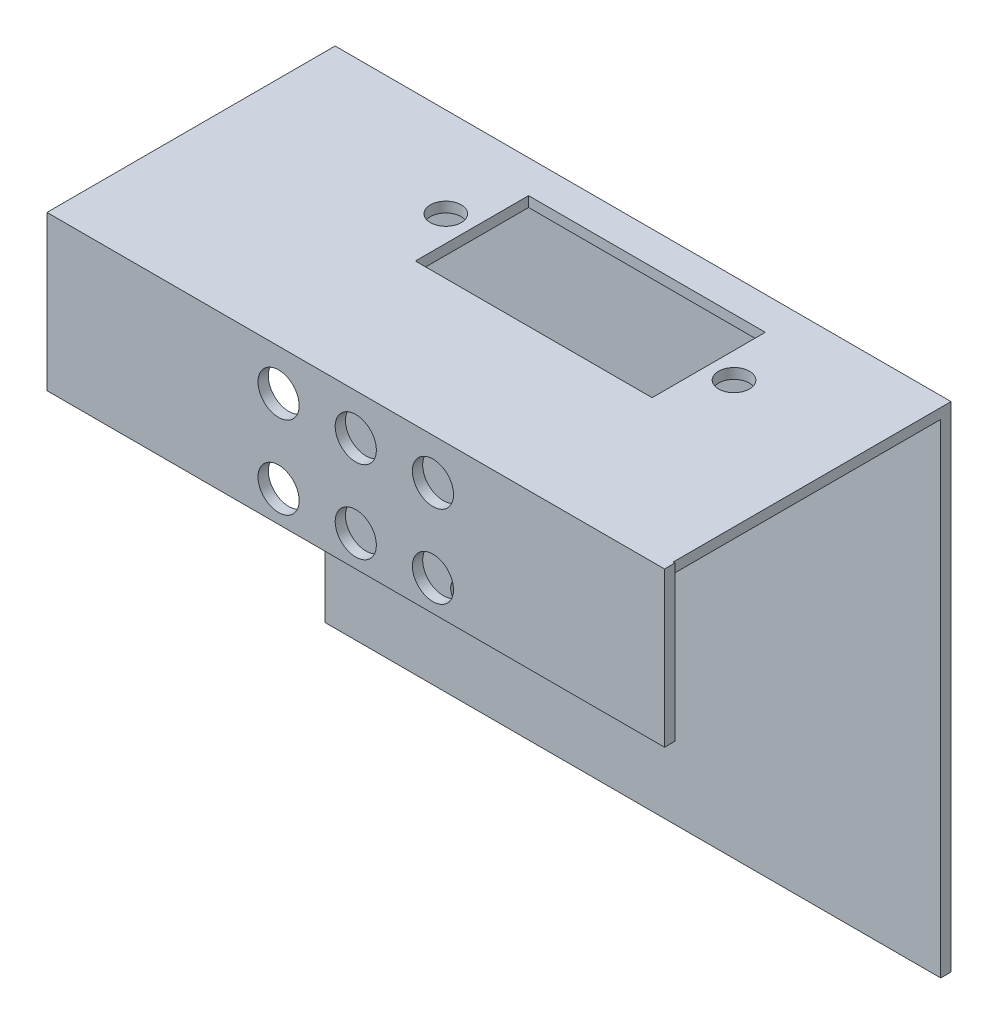
from build123d import *

# Parameters (mm, degrees)
ESQUISSE1_W             = 60
ESQUISSE1_H             = 15
BOSS_EXTRU_1_DEPTH      = 1
ESQUISSE2_W             = 59.836868209
ESQUISSE2_H             = 27
BOSS_EXTRU_2_DEPTH      = 1
ESQUISSE4_W             = 59.836868209
ESQUISSE4_H             = 47
BOSS_EXTRU_3_DEPTH      = 1
ESQUISSE6_R             = 2
ENL_V_MAT_EXTRU_5_DEPTH = 1
ESQUISSE8_W             = 23
ESQUISSE8_H             = 11
ENL_V_MAT_EXTRU_7_DEPTH = 1
ESQUISSE9_R             = 1.5
ENL_V_MAT_EXTRU_8_DEPTH = 1
ESQUISSE10_R            = 1.25
ENL_V_MAT_EXTRU_9_DEPTH = 1


with BuildPart() as part:
    # Esquisse1 → Boss.-Extru.1 (new body)
    with BuildSketch(Plane.XY):
        Rectangle(ESQUISSE1_W, ESQUISSE1_H)
    extrude(amount=BOSS_EXTRU_1_DEPTH)

    # Esquisse2 → Boss.-Extru.2 (add)
    with BuildSketch(Plane(origin=(0, 7.5, 0), x_dir=(1, 0, 0), z_dir=(0, 1, 0))):
        with Locations((-0.085609374, 13.5)):
            Rectangle(ESQUISSE2_W, ESQUISSE2_H)
    extrude(amount=-BOSS_EXTRU_2_DEPTH)

    # Esquisse4 → Boss.-Extru.3 (add)
    with BuildSketch(Plane.XY.offset(-27)):
        with Locations((-0.085609374, -17)):
            Rectangle(ESQUISSE4_W, ESQUISSE4_H)
    extrude(amount=BOSS_EXTRU_3_DEPTH)

    # Esquisse6 → Enlèv. mat.-Extru.5 (cut)
    with BuildSketch(Plane.XY.offset(1)):
        with Locations((-7.5, 3.5)):
            Circle(ESQUISSE6_R)
        with Locations((0, 3.5)):
            Circle(ESQUISSE6_R)
        with Locations((7.5, 3.5)):
            Circle(ESQUISSE6_R)
        with Locations(Location((7.5, -4.5, 0), (0, 0, 180))):
            Circle(ESQUISSE6_R)
        with Locations(Location((0, -4.5, 0), (0, 0, 180))):
            Circle(ESQUISSE6_R)
        with Locations(Location((-7.5, -4.5, 0), (0, 0, 180))):
            Circle(ESQUISSE6_R)
    extrude(amount=-ENL_V_MAT_EXTRU_5_DEPTH, mode=Mode.SUBTRACT)

    # Esquisse8 → Enlèv. mat.-Extru.7 (cut)
    with BuildSketch(Plane(origin=(0, 7.5, 0), x_dir=(1, 0, 0), z_dir=(0, 1, 0))):
        with Locations((3.484076767, 18.307447957)):
            Rectangle(ESQUISSE8_W, ESQUISSE8_H)
    extrude(amount=-ENL_V_MAT_EXTRU_7_DEPTH, mode=Mode.SUBTRACT)

    # Esquisse9 → Enlèv. mat.-Extru.8 (cut)
    with BuildSketch(Plane(origin=(0, 7.5, 0), x_dir=(1, 0, 0), z_dir=(0, 1, 0))):
        with Locations(Location((17.484076767, 18.264970918, 0), (0, 0, 180))):
            Circle(ESQUISSE9_R)
        with Locations(Location((-10.515923233, 18.264970918, 0), (0, 0, 180))):
            Circle(ESQUISSE9_R)
    extrude(amount=-ENL_V_MAT_EXTRU_8_DEPTH, mode=Mode.SUBTRACT)

    # Esquisse10 → Enlèv. mat.-Extru.9 (cut)
    with BuildSketch(Plane(origin=(0, 0, -27), x_dir=(-1, 0, 0), z_dir=(0, 0, -1))):
        with Locations((16.528262126, -31.490674341)):
            Circle(ESQUISSE10_R)
        with Locations((16.074327743, -9.995466885)):
            Circle(ESQUISSE10_R)
    extrude(amount=-ENL_V_MAT_EXTRU_9_DEPTH, mode=Mode.SUBTRACT)


solid = part.part
